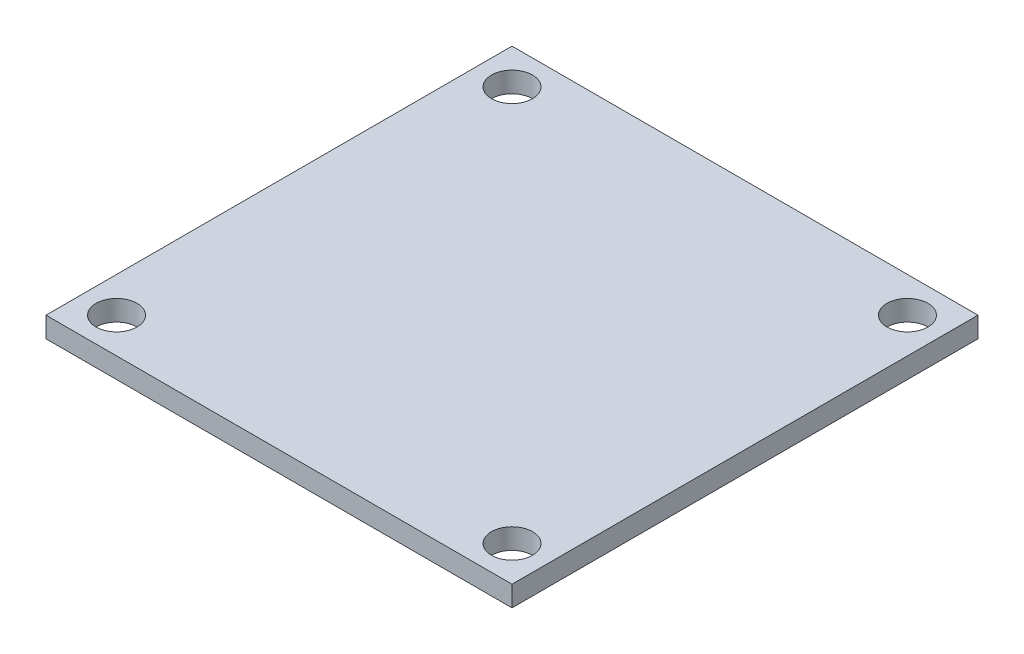
from build123d import *

# Parameters (mm, degrees)
SKETCH2_W           = 36.068
SKETCH2_H           = 36.068
SKETCH2_R           = 1.5875
BOSS_EXTRUDE1_DEPTH = 0.79375


with BuildPart() as part:
    # Sketch2 → Boss-Extrude1 (new, symmetric)
    with BuildSketch(Plane(origin=(0, 0, 0), x_dir=(1, 0, 0), z_dir=(0, 1, 0))):
        Rectangle(SKETCH2_W, SKETCH2_H)
        with Locations(Location((-15.3035, 15.3035, 0), (0, 0, 270))):
            Circle(SKETCH2_R, mode=Mode.SUBTRACT)
        with Locations(Location((-15.3035, -15.3035, 0), (0, 0, 90))):
            Circle(SKETCH2_R, mode=Mode.SUBTRACT)
        with Locations(Location((15.3035, -15.3035, 0), (0, 0, 270))):
            Circle(SKETCH2_R, mode=Mode.SUBTRACT)
        with Locations(Location((15.3035, 15.3035, 0), (0, 0, 90))):
            Circle(SKETCH2_R, mode=Mode.SUBTRACT)
    extrude(amount=BOSS_EXTRUDE1_DEPTH, both=True)


solid = part.part
